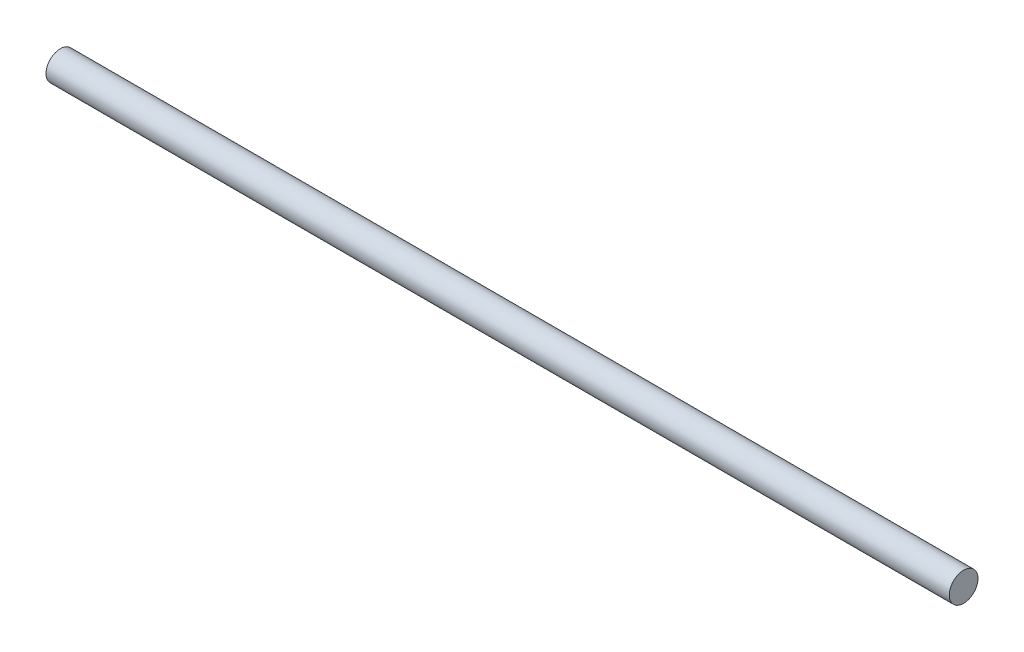
from build123d import *

# Parameters (mm, degrees)
SKETCH1_W           = 175.4666
SKETCH1_H           = 3
SKETCH3_R           = 3
BOSS_EXTRUDE1_DEPTH = 10
SKETCH7_R           = 3
BOSS_EXTRUDE5_DEPTH = 3


with BuildPart() as part:
    # Sketch1 → Revolve2 (revolve)
    with BuildSketch(Plane(origin=(0, 0, 0), x_dir=(1, 0, 0), z_dir=(0, 1, 0)), mode=Mode.PRIVATE) as revolve2_sk:
        with Locations((46.032622124, -14.621103214)):
            Rectangle(SKETCH1_W, SKETCH1_H)
    revolve(revolve2_sk.sketch.rotate(Axis((133.765922124, 0, 13.121103214), (-1, 0, 0)), 180), axis=Axis((133.765922124, 0, 13.121103214), (-1, 0, 0)))

    # Sketch3 → Boss-Extrude1 (add)
    with BuildSketch(Plane.ZY.offset(41.700677876)):
        with Locations(Location((13.121103214, 0, 0), (0, 0, 180))):
            Circle(SKETCH3_R)
    extrude(amount=BOSS_EXTRUDE1_DEPTH)

    # Sketch7 → Boss-Extrude5 (add)
    with BuildSketch(Plane.ZY.offset(51.700677876)):
        with Locations(Location((13.121103214, 0, 0), (0, 0, 180))):
            Circle(SKETCH7_R)
    extrude(amount=BOSS_EXTRUDE5_DEPTH)


solid = part.part
